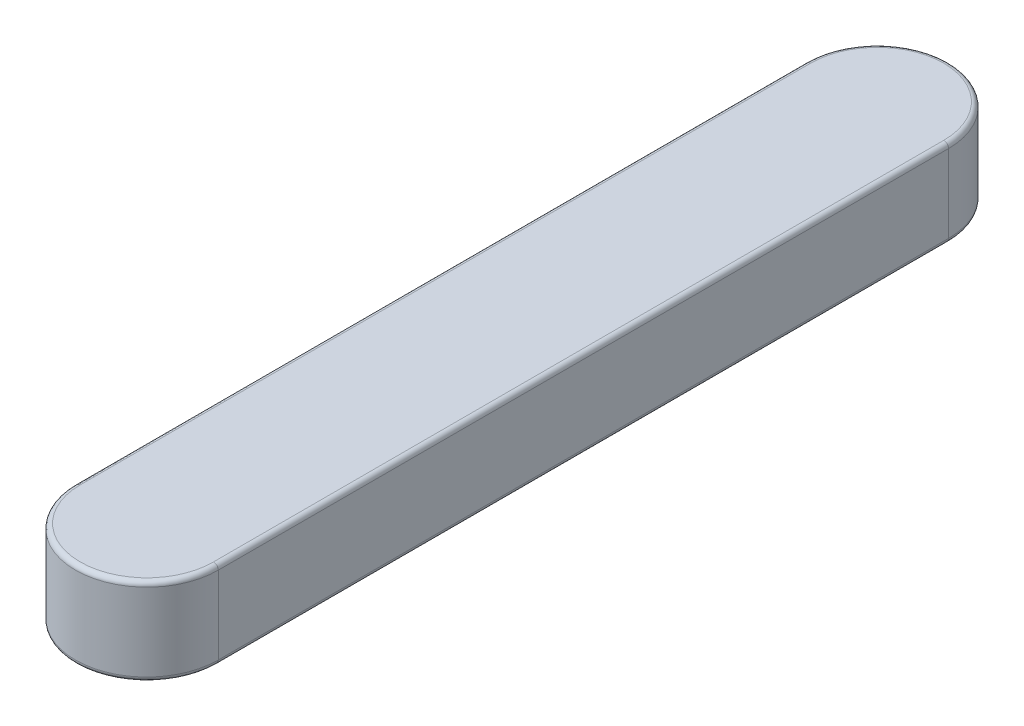
from build123d import *

# Parameters (mm, degrees)
EXTRUDE_1_DEPTH = 11
FILLET_1_R      = 0.6


with BuildPart() as part:
    # Эскиз1 → Бобышка-Вытянуть1 (new body)
    with BuildSketch(Plane(origin=(0, 0, 0), x_dir=(1, 0, 0), z_dir=(0, 1, 0))):
        with BuildLine():
            Line((-9, 0), (-9, 92))
            ThreePointArc((-9, 92), (0, 101), (9, 92))
            Line((9, 92), (9, 0))
            ThreePointArc((9, 0), (0, -9), (-9, 0))
        make_face()
    extrude(amount=EXTRUDE_1_DEPTH)

    # Скругление1
    fillet_1_edges = [part.edges().sort_by_distance(p)[0] for p in [
        (0, 11, -101),
        (-9, 11, -46),
        (0, 11, 9),
        (-9, 0, -46),
        (0, 0, -101),
        (9, 0, -46),
        (0, 0, 9),
        (9, 11, -46),
    ]]
    fillet(fillet_1_edges, radius=FILLET_1_R)


solid = part.part
